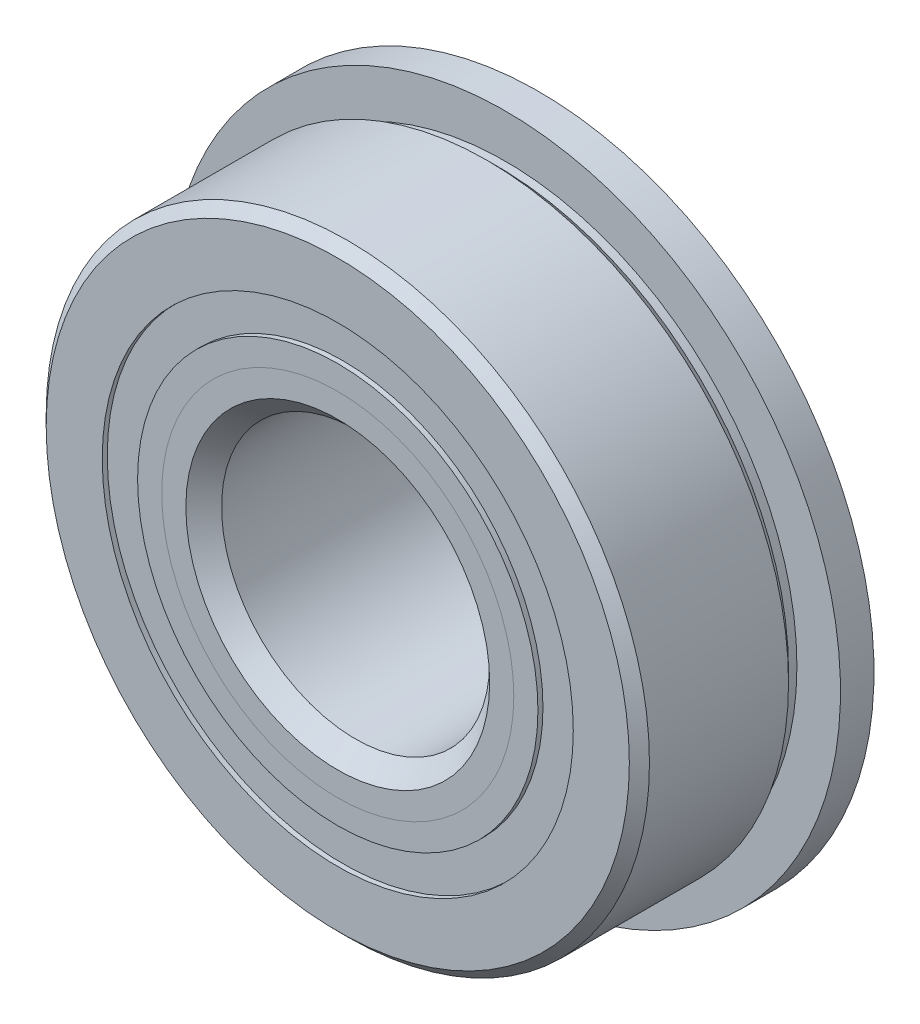
from build123d import *

# Parameters (mm, degrees)
SKETCH5_W         = 1.5875
SKETCH5_H         = 3.391318681
CIRPATTERN1_COUNT = 12
SKETCH7_W         = 2.248094269
SKETCH7_H         = 1.674725274


with BuildPart() as part:
    # Sketch1 → Revolve1 (revolve)
    with BuildSketch(Plane(origin=(0, 0, 0), x_dir=(0, 0, -1), z_dir=(1, 0, 0))):
        with BuildLine():
            Line((4.28625, 14.2875), (-4.28625, 14.2875))
            Line((-4.28625, 14.2875), (-4.7625, 13.81125))
            Line((-4.7625, 13.81125), (-4.7625, 11.156112637))
            Line((-4.7625, 11.156112637), (-2.116666667, 11.156112637))
            ThreePointArc((-2.116666667, 11.156112637), (0, 12.595030731), (2.116666667, 11.156112637))
            Line((2.116666667, 11.156112637), (4.7625, 11.156112637))
            Line((4.7625, 11.156112637), (4.7625, 13.81125))
            Line((4.7625, 13.81125), (4.28625, 14.2875))
        make_face()
    revolve(axis=Axis((0, 0, 4.7625), (0, 0, -1)))

    # Sketch5 → Revolve5 (revolve)
    with BuildSketch(Plane(origin=(0, 0, 0), x_dir=(0, 0, -1), z_dir=(1, 0, 0))):
        with Locations((3.96875, 14.17934066)):
            Rectangle(SKETCH5_W, SKETCH5_H)
    revolve(axis=Axis((0, 0, -6.35), (0, 0, 1)))

    # Sketch6 → Cut-Revolve1 (revolve, cut)
    with BuildSketch(Plane(origin=(0, 0, 0), x_dir=(0, 0, -1), z_dir=(1, 0, 0))):
        Polygon((2.301875, 14.2875), (2.778125, 13.81125), (3.175, 13.81125), (3.175, 14.2875), align=None)
    revolve(axis=Axis((0, 0, 4.7625), (0, 0, -1)), mode=Mode.SUBTRACT)


with BuildPart() as body_2:
    # Sketch2 → Revolve2 (revolve)
    with BuildSketch(Plane(origin=(0, 0, 0), x_dir=(0, 0, -1), z_dir=(1, 0, 0))):
        with BuildLine():
            Line((-4.7625, 9.481387363), (-2.116666667, 9.481387363))
            ThreePointArc((-2.116666667, 9.481387363), (-1.279722925, 8.436261434), (0, 8.042469269))
            Line((0, 8.042469269), (0, 7.196234635))
            Line((0, 7.196234635), (-3.619923636, 7.196234635))
            Line((-3.619923636, 7.196234635), (-4.7625, 8.338810999))
            Line((-4.7625, 8.338810999), (-4.7625, 9.481387363))
        make_face()
    revolve(axis=Axis((0, 0, 4.7625), (0, 0, -1)))


with BuildPart() as body_3:
    # Sketch3 → Revolve3 (revolve)
    with BuildSketch(Plane(origin=(0, 0, 0), x_dir=(0, 0, -1), z_dir=(1, 0, 0))):
        with BuildLine():
            Line((-4.7625, 8.338810999), (-3.619923636, 7.196234635))
            Line((-3.619923636, 7.196234635), (0, 7.196234635))
            Line((0, 7.196234635), (0, 8.042469269))
            ThreePointArc((0, 8.042469269), (1.279722925, 8.436261434), (2.116666667, 9.481387363))
            Line((2.116666667, 9.481387363), (6.35, 9.481387363))
            Line((6.35, 9.481387363), (6.35, 6.82625))
            Line((6.35, 6.82625), (5.87375, 6.35))
            Line((5.87375, 6.35), (-3.916265365, 6.35))
            Line((-3.916265365, 6.35), (-4.7625, 7.196234635))
            Line((-4.7625, 7.196234635), (-4.7625, 8.338810999))
        make_face()
    revolve(axis=Axis((0, 0, 4.7625), (0, 0, -1)))


with BuildPart() as body_4:
    # Sketch4 → Revolve4 (revolve)
    with BuildSketch(Plane(origin=(0, 0, 0), x_dir=(0, 0, -1), z_dir=(1, 0, 0))):
        with BuildLine():
            Line((-2.276280731, 10.31875), (2.276280731, 10.31875))
            ThreePointArc((2.276280731, 10.31875), (0, 12.595030731), (-2.276280731, 10.31875))
        make_face()
    revolve(axis=Axis((0, 10.31875, 2.276280731), (0, 0, -1)))


with BuildPart() as cirpattern1_1:
    # CirPattern1: pattern copy
    add(body_4.part.rotate(Axis((0, 0, -4.7625), (0, 0, 1)), 1 * 360 / CIRPATTERN1_COUNT))


with BuildPart() as cirpattern1_2:
    # CirPattern1: pattern copy
    add(body_4.part.rotate(Axis((0, 0, -4.7625), (0, 0, 1)), 2 * 360 / CIRPATTERN1_COUNT))


with BuildPart() as cirpattern1_3:
    # CirPattern1: pattern copy
    add(body_4.part.rotate(Axis((0, 0, -4.7625), (0, 0, 1)), 3 * 360 / CIRPATTERN1_COUNT))


with BuildPart() as cirpattern1_4:
    # CirPattern1: pattern copy
    add(body_4.part.rotate(Axis((0, 0, -4.7625), (0, 0, 1)), 4 * 360 / CIRPATTERN1_COUNT))


with BuildPart() as cirpattern1_5:
    # CirPattern1: pattern copy
    add(body_4.part.rotate(Axis((0, 0, -4.7625), (0, 0, 1)), 5 * 360 / CIRPATTERN1_COUNT))


with BuildPart() as cirpattern1_6:
    # CirPattern1: pattern copy
    add(body_4.part.rotate(Axis((0, 0, -4.7625), (0, 0, 1)), 6 * 360 / CIRPATTERN1_COUNT))


with BuildPart() as cirpattern1_7:
    # CirPattern1: pattern copy
    add(body_4.part.rotate(Axis((0, 0, -4.7625), (0, 0, 1)), 7 * 360 / CIRPATTERN1_COUNT))


with BuildPart() as cirpattern1_8:
    # CirPattern1: pattern copy
    add(body_4.part.rotate(Axis((0, 0, -4.7625), (0, 0, 1)), 8 * 360 / CIRPATTERN1_COUNT))


with BuildPart() as cirpattern1_9:
    # CirPattern1: pattern copy
    add(body_4.part.rotate(Axis((0, 0, -4.7625), (0, 0, 1)), 9 * 360 / CIRPATTERN1_COUNT))


with BuildPart() as cirpattern1_10:
    # CirPattern1: pattern copy
    add(body_4.part.rotate(Axis((0, 0, -4.7625), (0, 0, 1)), 10 * 360 / CIRPATTERN1_COUNT))


with BuildPart() as cirpattern1_11:
    # CirPattern1: pattern copy
    add(body_4.part.rotate(Axis((0, 0, -4.7625), (0, 0, 1)), 11 * 360 / CIRPATTERN1_COUNT))


with BuildPart() as body_16:
    # Sketch7 → Revolve6 (revolve)
    with BuildSketch(Plane(origin=(0, 0, 0), x_dir=(0, 0, -1), z_dir=(1, 0, 0))):
        with Locations((-3.400327865, 10.31875)):
            Rectangle(SKETCH7_W, SKETCH7_H)
        with Locations((3.400327865, 10.31875)):
            Rectangle(SKETCH7_W, SKETCH7_H)
    revolve(axis=Axis((0, 0, 4.7625), (0, 0, -1)))


solid = Compound([part.part, body_2.part, body_3.part, body_4.part, cirpattern1_1.part, cirpattern1_2.part, cirpattern1_3.part, cirpattern1_4.part, cirpattern1_5.part, cirpattern1_6.part, cirpattern1_7.part, cirpattern1_8.part, cirpattern1_9.part, cirpattern1_10.part, cirpattern1_11.part, body_16.part])
